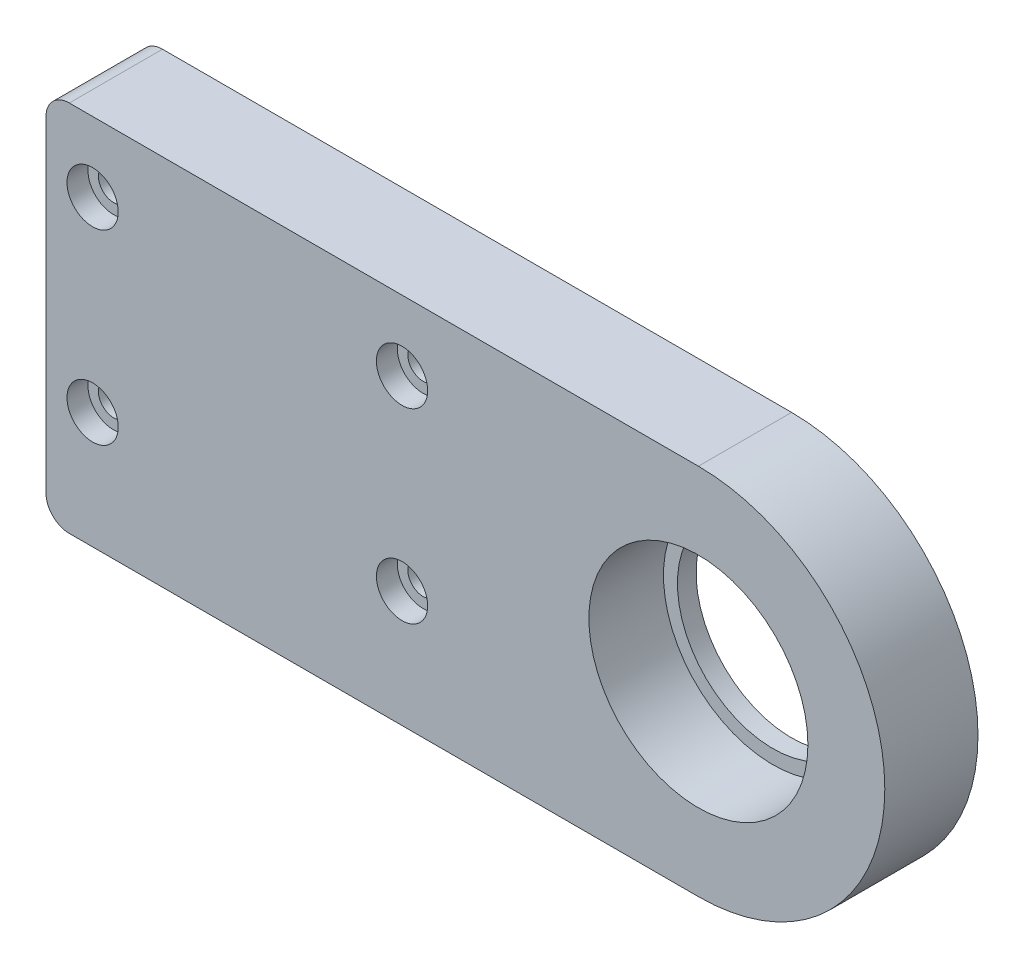
from build123d import *

# Parameters (mm, degrees)
SKETCH1_R           = 20.5
BOSS_EXTRUDE1_DEPTH = 20
SKETCH2_R           = 23.5
CUT_EXTRUDE1_DEPTH  = 16
SKETCH4_W           = 85
SKETCH4_H           = 8
BOSS_EXTRUDE2_DEPTH = 3
SKETCH3_R           = 3.25
CUT_EXTRUDE2_DEPTH  = 148.407598176
SKETCH5_R           = 5.5
CUT_EXTRUDE3_DEPTH  = 4.5
FILLET1_R           = 5


with BuildPart() as part:
    # Sketch1 → Boss-Extrude1 (new body)
    with BuildSketch(Plane.XY):
        with BuildLine():
            Line((0, 40), (-140, 40))
            Line((-140, 40), (-140, -40))
            Line((-140, -40), (0, -40))
            ThreePointArc((0, -40), (40, 0), (0, 40))
        make_face()
        Circle(SKETCH1_R, mode=Mode.SUBTRACT)
    extrude(amount=BOSS_EXTRUDE1_DEPTH)

    # Sketch2 → Cut-Extrude1 (cut)
    with BuildSketch(Plane.XY.offset(20)):
        Circle(SKETCH2_R)
    extrude(amount=-CUT_EXTRUDE1_DEPTH, mode=Mode.SUBTRACT)

    # Sketch4 → Boss-Extrude2 (add)
    with BuildSketch(Plane(origin=(0, 0, 0), x_dir=(-1, 0, 0), z_dir=(0, 0, -1))):
        with Locations((97.5, -15)):
            Rectangle(SKETCH4_W, SKETCH4_H)
        with Locations((97.5, 25)):
            Rectangle(SKETCH4_W, SKETCH4_H)
    extrude(amount=BOSS_EXTRUDE2_DEPTH)

    # Sketch3 → Cut-Extrude2 (cut, through all)
    with BuildSketch(Plane.XY.offset(20)):
        with Locations((-63.6, 25)):
            Circle(SKETCH3_R)
        with Locations((-130, 25)):
            Circle(SKETCH3_R)
        with Locations((-130, -15)):
            Circle(SKETCH3_R)
        with Locations((-63.6, -15)):
            Circle(SKETCH3_R)
    extrude(amount=-CUT_EXTRUDE2_DEPTH, mode=Mode.SUBTRACT)

    # Sketch5 → Cut-Extrude3 (cut)
    with BuildSketch(Plane.XY.offset(20)):
        with Locations((-130, 25)):
            Circle(SKETCH5_R)
        with Locations((-63.6, 25)):
            Circle(SKETCH5_R)
        with Locations((-63.6, -15)):
            Circle(SKETCH5_R)
        with Locations((-130, -15)):
            Circle(SKETCH5_R)
    extrude(amount=-CUT_EXTRUDE3_DEPTH, mode=Mode.SUBTRACT)

    # Fillet1
    fillet1_edges = [part.edges().sort_by_distance(p)[0] for p in [
        (-140, -40, 10),
        (-140, 40, 10),
    ]]
    fillet(fillet1_edges, radius=FILLET1_R)


solid = part.part
